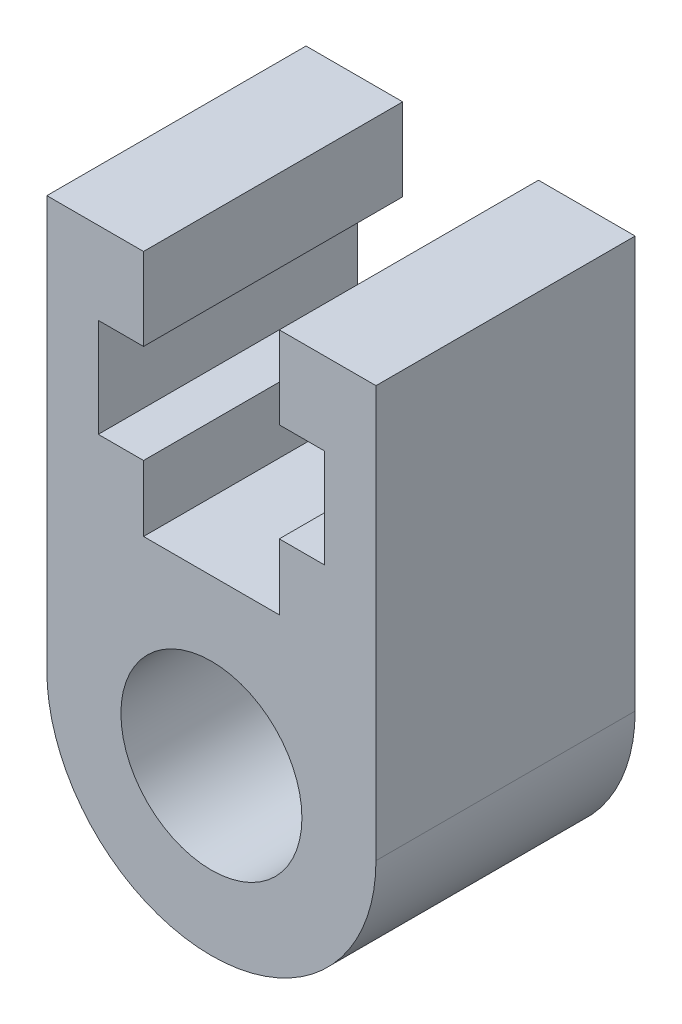
from build123d import *

# Parameters (mm, degrees)
SKETCH1_R           = 2.2
BOSS_EXTRUDE1_DEPTH = 6.3


with BuildPart() as part:
    # Sketch1 → Boss-Extrude1 (new body)
    with BuildSketch(Plane.XY):
        with BuildLine():
            Line((-4, 0), (-4, 10))
            Line((-4, 10), (-1.65, 10))
            Line((-1.65, 10), (-1.65, 8))
            Line((-1.65, 8), (-2.75, 8))
            Line((-2.75, 8), (-2.75, 5.6))
            Line((-2.75, 5.6), (-1.65, 5.6))
            Line((-1.65, 5.6), (-1.65, 4))
            Line((-1.65, 4), (1.65, 4))
            Line((1.65, 4), (1.65, 5.6))
            Line((1.65, 5.6), (2.75, 5.6))
            Line((2.75, 5.6), (2.75, 8))
            Line((2.75, 8), (1.65, 8))
            Line((1.65, 8), (1.65, 10))
            Line((1.65, 10), (4, 10))
            Line((4, 10), (4, 0))
            ThreePointArc((4, 0), (0, -4), (-4, 0))
        make_face()
        Circle(SKETCH1_R, mode=Mode.SUBTRACT)
    extrude(amount=BOSS_EXTRUDE1_DEPTH)


solid = part.part
